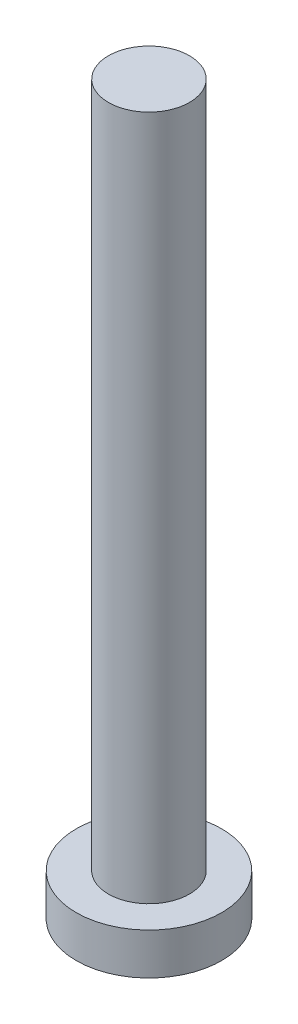
from build123d import *

# Parameters (mm, degrees)
BOSS_EXTRUDE1_START = -4
SKETCH1_R           = 7
BOSS_EXTRUDE1_DEPTH = 4
SKETCH2_R           = 3.9
BOSS_EXTRUDE2_DEPTH = 66


with BuildPart() as part:
    # Sketch1 → Boss-Extrude1 (new body)
    with BuildSketch(Plane(origin=(0, 0, 0), x_dir=(1, 0, 0), z_dir=(0, 1, 0)).offset(BOSS_EXTRUDE1_START)):
        with Locations(Location((0, 0, 0), (0, 0, 270))):
            Circle(SKETCH1_R)
    extrude(amount=BOSS_EXTRUDE1_DEPTH)

    # Sketch2 → Boss-Extrude2 (add)
    with BuildSketch(Plane(origin=(0, 0, 0), x_dir=(1, 0, 0), z_dir=(0, 1, 0))):
        with Locations(Location((0, 0, 0), (0, 0, 270))):
            Circle(SKETCH2_R)
    extrude(amount=BOSS_EXTRUDE2_DEPTH)


solid = part.part
